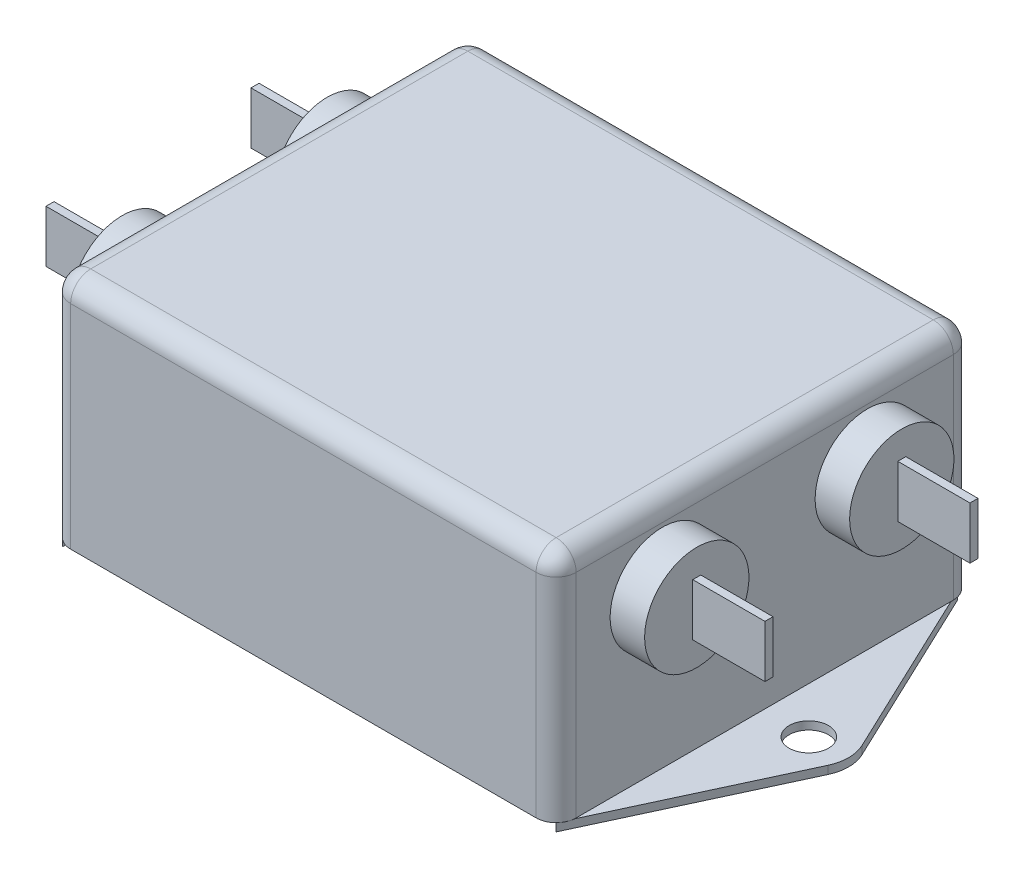
from build123d import *

# Parameters (mm, degrees)
SZKIC1_W                    = 63
SZKIC1_H                    = 52
DODANIE_WYCI_GNI_CIE1_DEPTH = 29
ZAOKR_GLENIE1_R             = 2.5
DODANIE_WYCI_GNI_CIE2_DEPTH = 1
SZKIC3_R                    = 2.45
WYTNIJ_WYCI_GNI_CIE6_DEPTH  = 62.065626678
SZKIC4_R                    = 6.5
DODANIE_WYCI_GNI_CIE3_DEPTH = 4.3
SZKIC5_W                    = 1
SZKIC5_H                    = 6.5
DODANIE_WYCI_GNI_CIE4_DEPTH = 9
LUSTRO4_COPY_1_SKETCH_W     = 1
LUSTRO4_COPY_1_SKETCH_H     = 6.5
LUSTRO4_COPY_1_DEPTH        = 9
LUSTRO4_COPY_2_SKETCH_W     = 1
LUSTRO4_COPY_2_SKETCH_H     = 6.5
LUSTRO4_COPY_2_DEPTH        = 9


with BuildPart() as part:
    # Szkic1 → Dodanie-wyciągnięcie1 (new body)
    with BuildSketch(Plane(origin=(0, 0, 0), x_dir=(1, 0, 0), z_dir=(0, 1, 0))):
        with Locations((2.222834646, 4.567716535)):
            Rectangle(SZKIC1_W, SZKIC1_H)
    extrude(amount=DODANIE_WYCI_GNI_CIE1_DEPTH)

    # Zaokrąglenie1
    zaokr_glenie1_edges = [part.edges().sort_by_distance(p)[0] for p in [
        (33.722834646, 29, -4.567716535),
        (2.222834646, 29, -30.567716535),
        (-29.277165354, 29, -4.567716535),
        (2.222834646, 29, 21.432283465),
        (-29.277165354, 14.5, -30.567716535),
        (33.722834646, 14.5, -30.567716535),
        (33.722834646, 14.5, 21.432283465),
        (-29.277165354, 14.5, 21.432283465),
    ]]
    fillet(zaokr_glenie1_edges, radius=ZAOKR_GLENIE1_R)

    # Szkic2 → Dodanie-wyciągnięcie2 (add)
    with BuildSketch(Plane.XZ):
        with BuildLine():
            Line((-39.289158378, -2.43984114), (-28.544932307, 20.700050418))
            Line((-28.544932307, 20.700050418), (-28.544932307, -29.312606034))
            Line((-28.544932307, -29.312606034), (-39.272080362, -6.687578711))
            ThreePointArc((-39.272080362, -6.687578711), (-39.754125902, -4.565613657), (-39.289158378, -2.43984114))
        make_face()
        with BuildLine():
            Line((32.990601599, 20.700050418), (32.990601599, -29.312606034))
            Line((32.990601599, -29.312606034), (43.717749653, -6.687578711))
            ThreePointArc((43.717749653, -6.687578711), (44.199795194, -4.565613657), (43.734827669, -2.43984114))
            Line((43.734827669, -2.43984114), (32.990601599, 20.700050418))
        make_face()
    extrude(amount=DODANIE_WYCI_GNI_CIE2_DEPTH)

    # Szkic3 → Wytnij-wyciągnięcie6 (cut, through all)
    with BuildSketch(Plane.XZ):
        with Locations(Location((-35.027165354, -4.306277808, 0), (0, 0, 270))):
            Circle(SZKIC3_R)
        with Locations(Location((39.472834646, -4.306277808, 0), (0, 0, 90))):
            Circle(SZKIC3_R)
    extrude(amount=WYTNIJ_WYCI_GNI_CIE6_DEPTH, mode=Mode.SUBTRACT)

    # Szkic4 → Dodanie-wyciągnięcie3 (add)
    with BuildSketch(Plane.ZY.offset(29.277165354)):
        with Locations(Location((8.206789605, 19.5, 0), (0, 0, 180))):
            Circle(SZKIC4_R)
        with Locations(Location((-17.342222675, 19.5, 0), (0, 0, 180))):
            Circle(SZKIC4_R)
    dodanie_wyci_gni_cie3 = extrude(amount=DODANIE_WYCI_GNI_CIE3_DEPTH)

    # Szkic5 → Dodanie-wyciągnięcie4 (add)
    with BuildSketch(Plane.ZY.offset(33.577165354)):
        with Locations((8.206789605, 19.5)):
            Rectangle(SZKIC5_W, SZKIC5_H)
    dodanie_wyci_gni_cie4 = extrude(amount=DODANIE_WYCI_GNI_CIE4_DEPTH)

    # Lustro1: Dodanie-wyciągnięcie4 across plane
    add(dodanie_wyci_gni_cie4.mirror(Plane(origin=(0, 0, -4.567716535), x_dir=(1, 0, 0), z_dir=(0, 0, -1))))

    # Lustro2: Dodanie-wyciągnięcie3 across plane
    add(dodanie_wyci_gni_cie3.mirror(Plane.ZY.offset(-2.222834646)))

    # Lustro3: Dodanie-wyciągnięcie4 across plane
    add(dodanie_wyci_gni_cie4.mirror(Plane.ZY.offset(-2.222834646)))

    # Lustro4 copy 1 sketch → Lustro4 copy 1 (add)
    with BuildSketch(Plane(origin=(38.022834646, 0, -9.135433071), x_dir=(0, 0, -1), z_dir=(1, 0, 0))):
        with Locations((8.206789605, 19.5)):
            Rectangle(LUSTRO4_COPY_1_SKETCH_W, LUSTRO4_COPY_1_SKETCH_H)
    extrude(amount=LUSTRO4_COPY_1_DEPTH)

    # Lustro4 copy 2 sketch → Lustro4 copy 2 (add)
    with BuildSketch(Plane(origin=(38.022834646, 0, 0), x_dir=(0, 0, 1), z_dir=(1, 0, 0))):
        with Locations((8.206789605, -19.5)):
            Rectangle(LUSTRO4_COPY_2_SKETCH_W, LUSTRO4_COPY_2_SKETCH_H)
    extrude(amount=LUSTRO4_COPY_2_DEPTH)


solid = part.part
